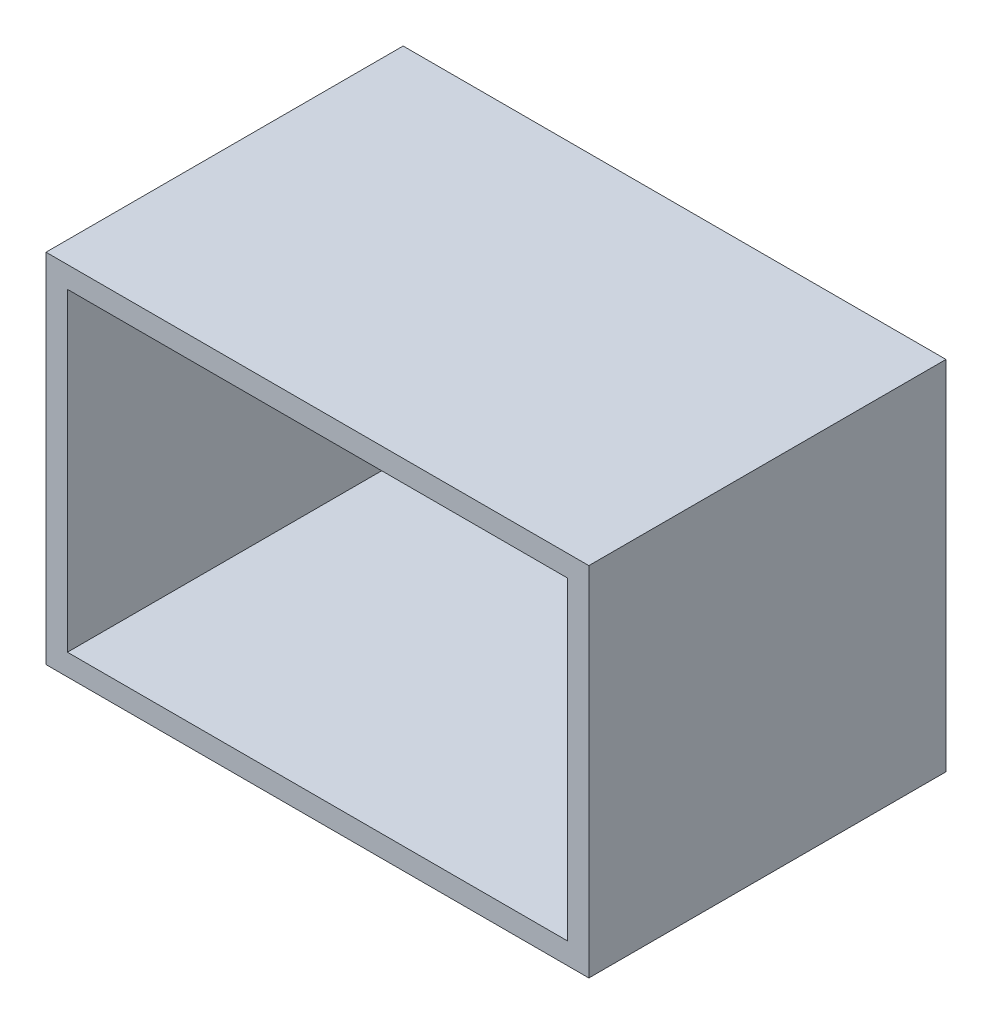
from build123d import *

# Parameters (mm, degrees)
SKETCH_1_W      = 76
SKETCH_1_H      = 50
SKETCH_1_W_2    = 70
SKETCH_1_H_2    = 44
EXTRUDE_1_DEPTH = 50


with BuildPart() as part:
    # 草图1 → 凸台-拉伸1 (new body)
    with BuildSketch(Plane.XY):
        Rectangle(SKETCH_1_W, SKETCH_1_H)
        Rectangle(SKETCH_1_W_2, SKETCH_1_H_2, mode=Mode.SUBTRACT)
    extrude(amount=EXTRUDE_1_DEPTH)


solid = part.part
